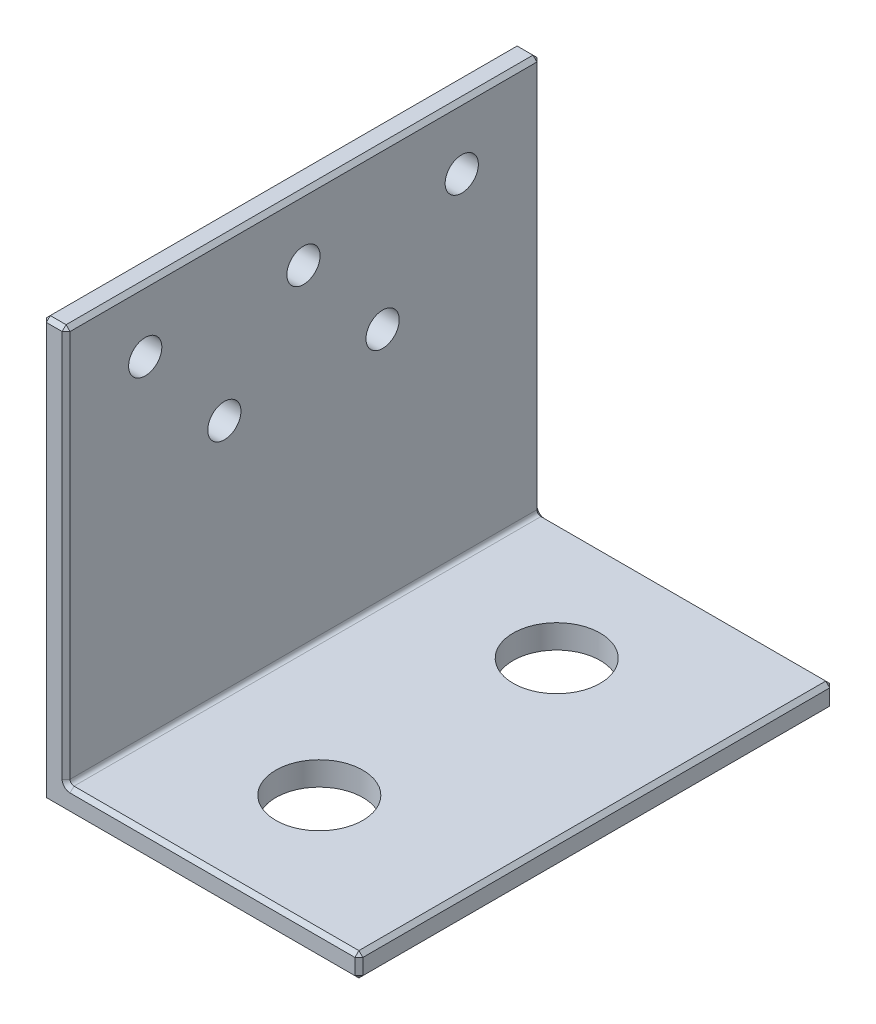
from build123d import *

# Parameters (mm, degrees)
DODANIE_WYCI_GNI_CIE1_DEPTH    = 60
OTWORY_USTALAJ_CE_1_0MM1_D     = 11
OTWORY_USTALAJ_CE_1_0MM1_DEPTH = 22.25
OTWORY_USTALAJ_CE_1_0MM1_TIP   = 3.304733405
OTW_R_GWINTOWANY_M51_D         = 4.2
OTW_R_GWINTOWANY_M51_DEPTH     = 14
OTW_R_GWINTOWANY_M51_TIP       = 1.2618073
ZAOKR_GLENIE1_R                = 0.5
SFAZOWANIE3_SIZE               = 0.5


with BuildPart() as part:
    # Szkic1 → Dodanie-wyciągnięcie1 (new body)
    with BuildSketch(Plane.XY):
        Polygon((0, 3), (0, 53), (3, 53), (3, 3), (40, 3), (40, 0), (0, 0), align=None)
    extrude(amount=DODANIE_WYCI_GNI_CIE1_DEPTH)

    # Otwory ustalające Ø1.0mm1
    with Locations(Plane(origin=(0, 3, 0), x_dir=(1, 0, 0), z_dir=(0, 1, 0))):
        with Locations((20, -45), (20, -15)):
            Hole(OTWORY_USTALAJ_CE_1_0MM1_D / 2, depth=OTWORY_USTALAJ_CE_1_0MM1_DEPTH)
            with Locations((0, 0, -(OTWORY_USTALAJ_CE_1_0MM1_DEPTH + OTWORY_USTALAJ_CE_1_0MM1_TIP / 2))):  # 118° drill point
                Cone(0, OTWORY_USTALAJ_CE_1_0MM1_D / 2, OTWORY_USTALAJ_CE_1_0MM1_TIP, mode=Mode.SUBTRACT)

    # Otwór gwintowany M51
    with Locations(Plane(origin=(3, 0, 0), x_dir=(0, 0, -1), z_dir=(1, 0, 0))):
        with Locations((-50, 45), (-40, 33), (-30, 45), (-20, 33), (-10, 45)):
            Hole(OTW_R_GWINTOWANY_M51_D / 2, depth=OTW_R_GWINTOWANY_M51_DEPTH)
            with Locations((0, 0, -(OTW_R_GWINTOWANY_M51_DEPTH + OTW_R_GWINTOWANY_M51_TIP / 2))):  # 118° drill point
                Cone(0, OTW_R_GWINTOWANY_M51_D / 2, OTW_R_GWINTOWANY_M51_TIP, mode=Mode.SUBTRACT)

    # Zaokrąglenie1
    zaokr_glenie1_edges = [part.edges().sort_by_distance(p)[0] for p in [
        (3, 3, 30),
    ]]
    fillet(zaokr_glenie1_edges, radius=ZAOKR_GLENIE1_R)

    # Sfazowanie3
    sfazowanie3_edges = [part.edges().sort_by_distance(p)[0] for p in [
        (0, 53, 30),
        (3, 53, 30),
        (40, 1.5, 60),
        (40, 3, 30),
        (40, 0, 30),
        (0, 0, 30),
        (21.75, 3, 60),
        (1.5, 53, 60),
        (0, 26.5, 60),
        (3, 28.25, 0),
        (3, 28.25, 60),
        (3.146446609, 3.146446609, 0),
        (3.146446609, 3.146446609, 60),
        (0, 26.5, 0),
        (1.5, 53, 0),
        (21.75, 3, 0),
        (20, 0, 60),
        (40, 1.5, 0),
        (20, 0, 0),
    ]]
    chamfer(sfazowanie3_edges, length=SFAZOWANIE3_SIZE)


solid = part.part
